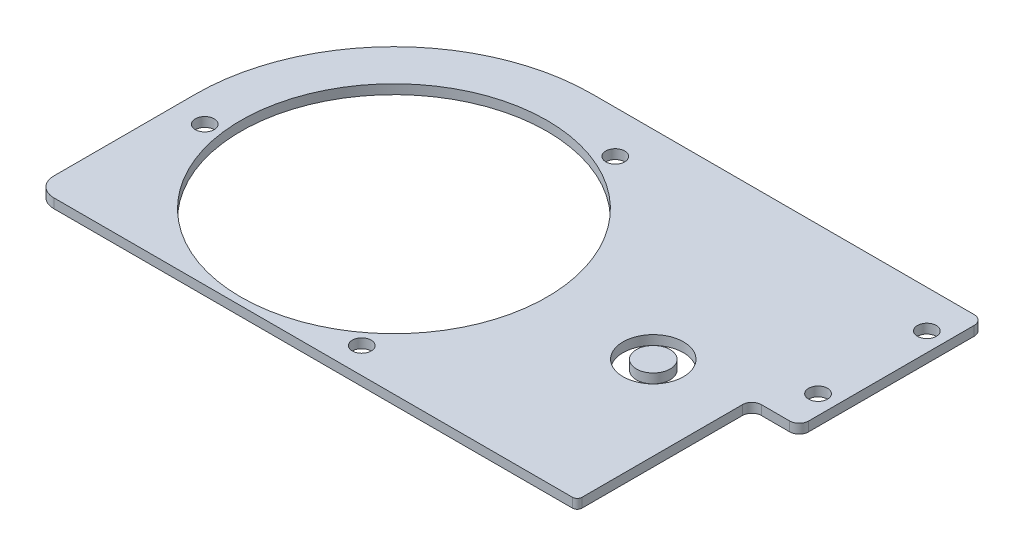
from build123d import *

# Parameters (mm, degrees)
SKETCH1_R           = 102.87
SKETCH1_R_2         = 6.35
BOSS_EXTRUDE1_DEPTH = 6.35
SKETCH6_R           = 20.32
SKETCH6_R_2         = 11.322751343
CUT_EXTRUDE1_DEPTH  = 28.448


with BuildPart() as part:
    # Sketch1 → Boss-Extrude1 (new body)
    with BuildSketch(Plane(origin=(0, 0, 0), x_dir=(1, 0, 0), z_dir=(0, 1, 0))):
        with BuildLine():
            Line((256.521079071, 133.368920929), (0, 133.368920929))
            ThreePointArc((0, 133.368920929), (-94.306068389, 94.306068389), (-133.368920929, 0))
            Line((-133.368920929, 0), (-133.368920929, -95.231079071))
            ThreePointArc((-133.368920929, -95.231079071), (-129.64917705, -104.211335192), (-120.668920929, -107.931079071))
            Line((-120.668920929, -107.931079071), (227.955539535, -107.931079071))
            ThreePointArc((227.955539535, -107.931079071), (230.193914007, -107.003914007), (231.121079071, -104.765539535))
            Line((231.121079071, -104.765539535), (231.121079071, 3.100777109))
            ThreePointArc((231.121079071, 3.100777109), (232.98095101, 7.59090517), (237.471079071, 9.450777109))
            Line((237.471079071, 9.450777109), (256.521079071, 9.450777109))
            ThreePointArc((256.521079071, 9.450777109), (261.011207131, 11.310649048), (262.871079071, 15.800777109))
            Line((262.871079071, 15.800777109), (262.871079071, 127.018920929))
            ThreePointArc((262.871079071, 127.018920929), (261.011207131, 131.50904899), (256.521079071, 133.368920929))
        make_face()
        with Locations(Location((0, 0, 0), (0, 0, 270))):
            Circle(SKETCH1_R, mode=Mode.SUBTRACT)
        with Locations(Location((-112.738641363, -14.374963544, 0), (0, 0, 270))):
            Circle(SKETCH1_R_2, mode=Mode.SUBTRACT)
        with Locations(Location((43.920237074, 104.822009181, 0), (0, 0, 270))):
            Circle(SKETCH1_R_2, mode=Mode.SUBTRACT)
        with Locations(Location((68.818404289, -90.447045637, 0), (0, 0, 270))):
            Circle(SKETCH1_R_2, mode=Mode.SUBTRACT)
        with Locations(Location((250.171079071, 107.968920929, 0), (0, 0, 270))):
            Circle(SKETCH1_R_2, mode=Mode.SUBTRACT)
        with Locations(Location((250.171079071, 34.850777109, 0), (0, 0, 270))):
            Circle(SKETCH1_R_2, mode=Mode.SUBTRACT)
    extrude(amount=BOSS_EXTRUDE1_DEPTH)

    # Sketch6 → Cut-Extrude1 (cut)
    with BuildSketch(Plane(origin=(0, 0, 0), x_dir=(1, 0, 0), z_dir=(0, 1, 0))):
        with Locations(Location((174.751369453, -0.469444786, 0), (0, 0, 90))):
            Circle(SKETCH6_R)
        with Locations(Location((174.751369453, -0.469444786, 0), (0, 0, 90))):
            Circle(SKETCH6_R_2, mode=Mode.SUBTRACT)
    extrude(amount=CUT_EXTRUDE1_DEPTH, mode=Mode.SUBTRACT)


with BuildPart() as cut_extrude1_piece_1:
    # of the separate pieces the step leaves, piece 1, a body of its own (cut_extrude1_pieces)
    add(part.part.solids().sort_by_distance((256.521079071, 0, -9.450777109))[0])


with BuildPart() as cut_extrude1_piece_2:
    # of the separate pieces the step leaves, piece 2, a body of its own (cut_extrude1_pieces)
    add(part.part.solids().sort_by_distance((174.751369453, 0, -10.853306558))[0])


solid = Compound([cut_extrude1_piece_1.part, cut_extrude1_piece_2.part])
